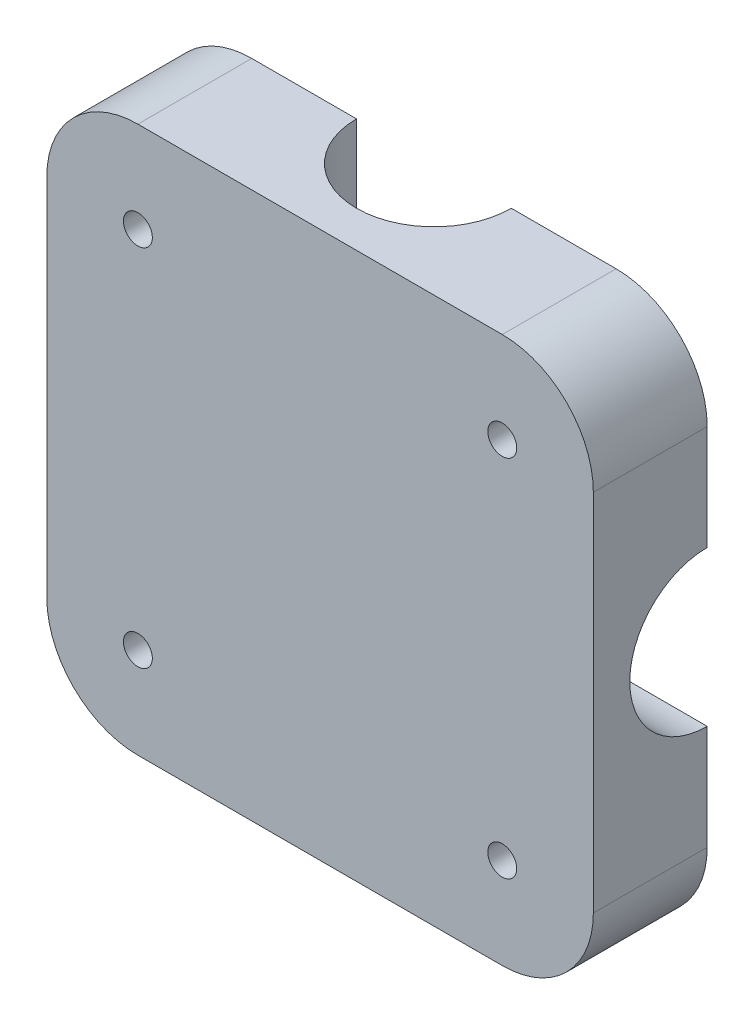
from build123d import *

# Parameters (mm, degrees)
SALIENTE_EXTRUIR1_DEPTH = 12.5
CROQUIS2_R              = 8.5
CORTAR_EXTRUIR1_DEPTH   = 41.25
CROQUIS3_R              = 8.5
CORTAR_EXTRUIR2_DEPTH   = 82.5
CROQUIS4_R              = 1.5875
CORTAR_EXTRUIR3_DEPTH   = 82.5


with BuildPart() as part:
    # Croquis1 → Saliente-Extruir1 (new body)
    with BuildSketch(Plane.XY):
        with BuildLine():
            Line((-20, -30), (20, -30))
            ThreePointArc((20, -30), (27.071067812, -27.071067812), (30, -20))
            Line((30, -20), (30, 20))
            ThreePointArc((30, 20), (27.071067812, 27.071067812), (20, 30))
            Line((20, 30), (-20, 30))
            ThreePointArc((-20, 30), (-27.071067812, 27.071067812), (-30, 20))
            Line((-30, 20), (-30, -20))
            ThreePointArc((-30, -20), (-27.071067812, -27.071067812), (-20, -30))
        make_face()
    extrude(amount=SALIENTE_EXTRUIR1_DEPTH)

    # Croquis2 → Cortar-Extruir1 (cut, symmetric)
    with BuildSketch(Plane(origin=(0, 0, 0), x_dir=(1, 0, 0), z_dir=(0, 1, 0))):
        Circle(CROQUIS2_R)
    extrude(amount=CORTAR_EXTRUIR1_DEPTH, both=True, mode=Mode.SUBTRACT)

    # Croquis3 → Cortar-Extruir2 (cut)
    with BuildSketch(Plane.ZY.offset(30)):
        Circle(CROQUIS3_R)
    extrude(amount=-CORTAR_EXTRUIR2_DEPTH, mode=Mode.SUBTRACT)

    # Croquis4 → Cortar-Extruir3 (cut)
    with BuildSketch(Plane.XY.offset(12.5)):
        with Locations((-20, 20)):
            Circle(CROQUIS4_R)
        with Locations((20, 20)):
            Circle(CROQUIS4_R)
        with Locations((20, -20)):
            Circle(CROQUIS4_R)
        with Locations((-20, -20)):
            Circle(CROQUIS4_R)
    extrude(amount=-CORTAR_EXTRUIR3_DEPTH, mode=Mode.SUBTRACT)


solid = part.part
